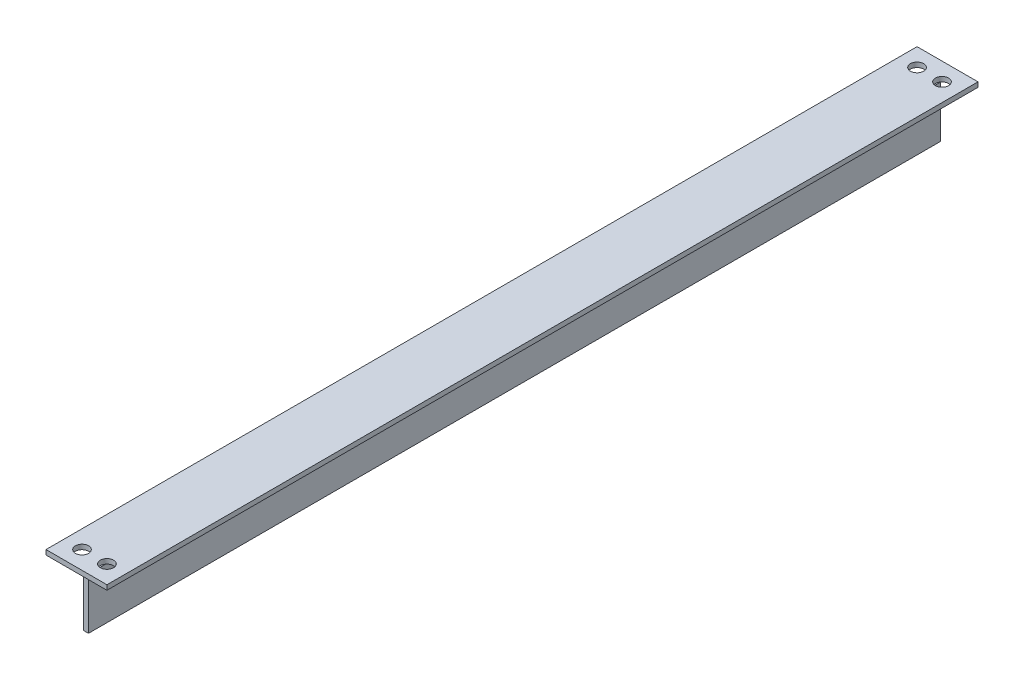
from build123d import *

# Parameters (mm, degrees)
RESSALTO_EXTRUS_O1_DEPTH     = 181.5
CORTE_EXTRUS_O2_DEPTH        = 50
FURO_DE_DI_METRO_5_5_5_5_1_D = 5.5


with BuildPart() as part:
    # Esboço1 → Ressalto-extrusão1 (new, symmetric)
    with BuildSketch(Plane.XY):
        Polygon((-12.7, 0), (12.7, 0), (12.7, -2), (1, -2), (1, -25.4), (-1, -25.4), (-1, -2), (-12.7, -2), align=None)
    extrude(amount=RESSALTO_EXTRUS_O1_DEPTH, both=True)

    # Esboço3 → Corte-extrusão2 (cut, symmetric)
    with BuildSketch(Plane(origin=(0, 0, 0), x_dir=(0, 0, -1), z_dir=(1, 0, 0))):
        Polygon((-177.5, -4), (-168, -4), (-168, -2), (-181.5, -2), (-181.5, -25.4), (-177.5, -25.4), align=None)
        Polygon((181.5, -25.4), (177.5, -25.4), (177.5, -4), (168, -4), (168, -2), (181.5, -2), align=None)
    extrude(amount=CORTE_EXTRUS_O2_DEPTH, both=True, mode=Mode.SUBTRACT)

    # Furo de diâmetro Ø5.5 (5.5)1 (through all)
    with Locations(Plane(origin=(0, 0, 0), x_dir=(1, 0, 0), z_dir=(0, 1, 0))):
        with Locations((5.2, -174), (-5.2, -174), (-5.2, 174), (5.2, 174)):
            Hole(FURO_DE_DI_METRO_5_5_5_5_1_D / 2)


solid = part.part
